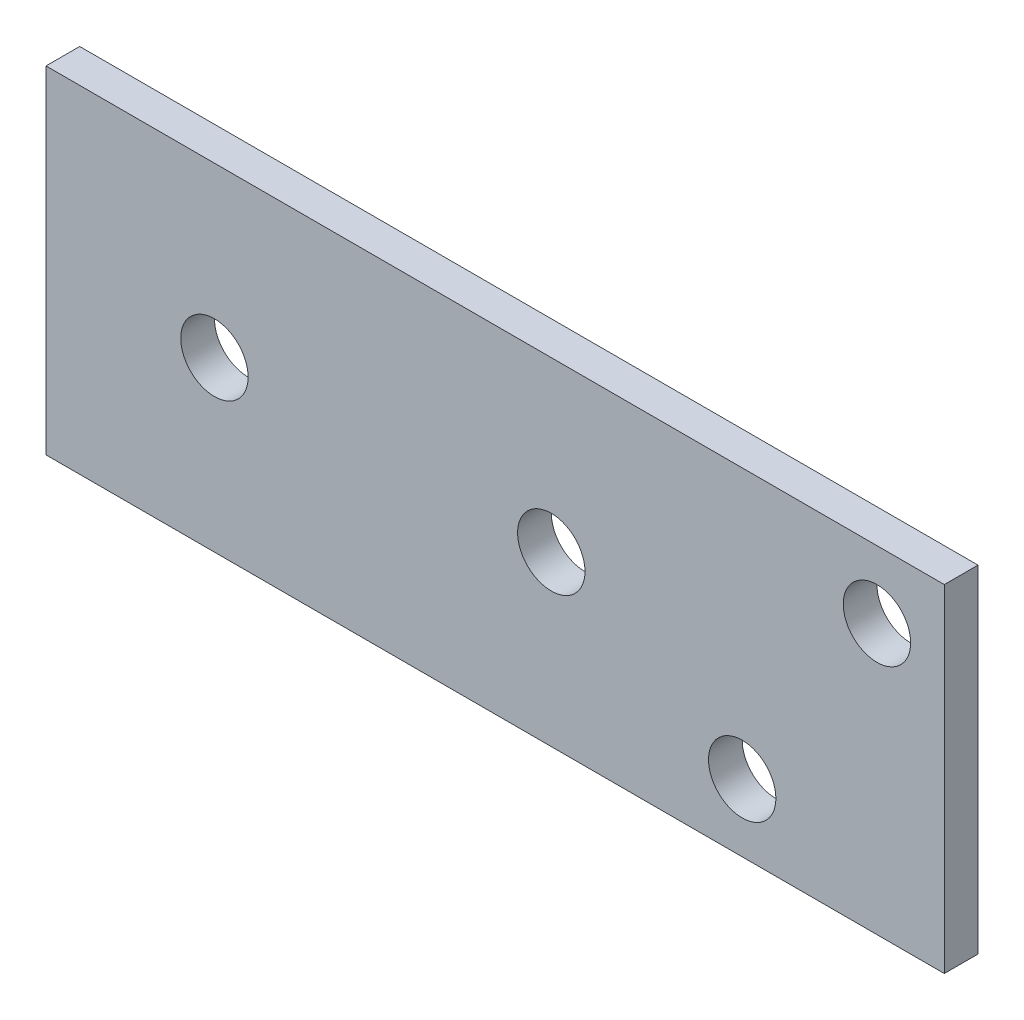
from build123d import *

# Parameters (mm, degrees)
ESQUISSE1_W      = 40
ESQUISSE1_H      = 15
ESQUISSE1_R      = 1.5
EXTRUSION1_DEPTH = 1.5
ESQUISSE2_R      = 1.5
EXTRUSION2_DEPTH = 1.5


with BuildPart() as part:
    # Esquisse1 → Extrusion1 (new body)
    with BuildSketch(Plane.XY):
        with Locations((-7.910187919, 3.943730074)):
            Rectangle(ESQUISSE1_W, ESQUISSE1_H)
        with Locations((-20.410187919, 3.943730074)):
            Circle(ESQUISSE1_R, mode=Mode.SUBTRACT)
        with Locations((-5.410187919, 3.943730074)):
            Circle(ESQUISSE1_R, mode=Mode.SUBTRACT)
    extrude(amount=EXTRUSION1_DEPTH)

    # Esquisse2 → Extrusion2 (cut)
    with BuildSketch(Plane.XY.offset(1.5)):
        with Locations((9.089812081, 8.443730074)):
            Circle(ESQUISSE2_R)
        with Locations((3.089812081, -0.556269926)):
            Circle(ESQUISSE2_R)
    extrude(amount=-EXTRUSION2_DEPTH, mode=Mode.SUBTRACT)


solid = part.part
